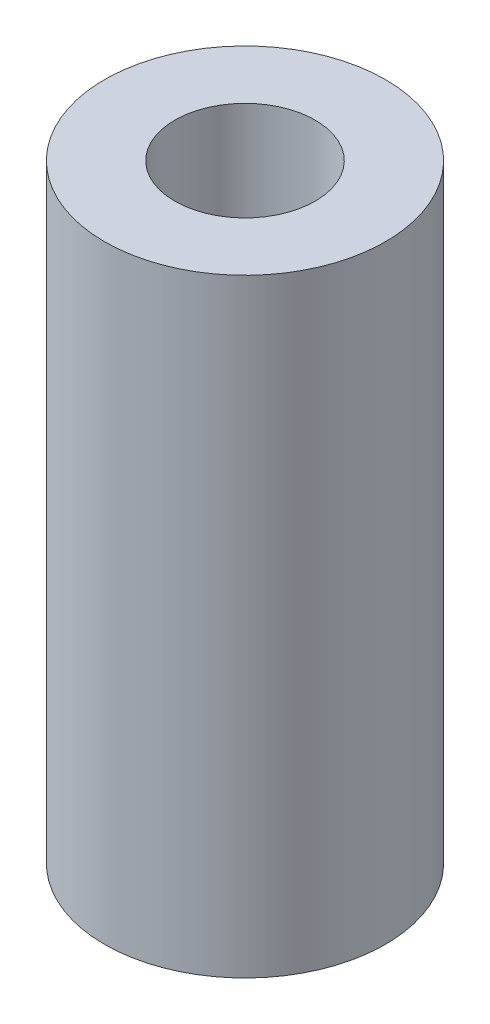
from build123d import *

# Parameters (mm, degrees)
SKETCH2_R           = 6
SKETCH2_R_2         = 3
BOSS_EXTRUDE1_DEPTH = 26


with BuildPart() as part:
    # Sketch2 → Boss-Extrude1 (new body)
    with BuildSketch(Plane(origin=(0, 0, 0), x_dir=(1, 0, 0), z_dir=(0, 1, 0))):
        with Locations(Location((0, 0, 0), (0, 0, 270))):
            Circle(SKETCH2_R)
        with Locations(Location((0, 0, 0), (0, 0, 270))):
            Circle(SKETCH2_R_2, mode=Mode.SUBTRACT)
    extrude(amount=BOSS_EXTRUDE1_DEPTH)


solid = part.part
